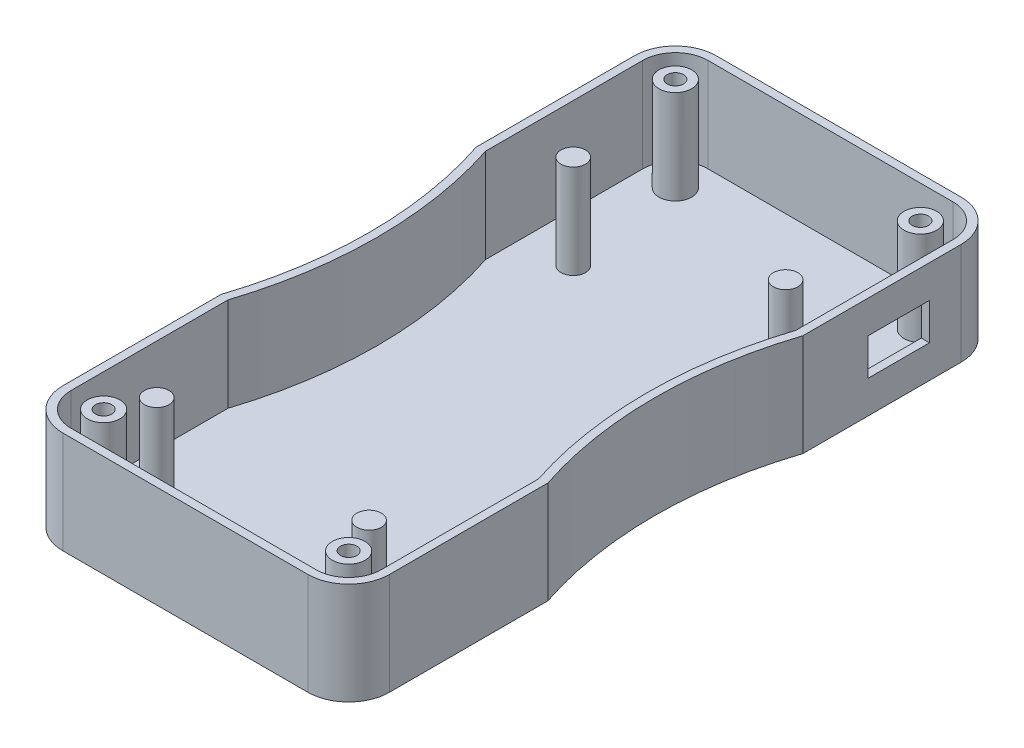
from build123d import *

# Parameters (mm, degrees)
SKETCH1_W           = 80
SKETCH1_H           = 160
BOSS_EXTRUDE1_DEPTH = 25
SKETCH2_R           = 100
CUT_EXTRUDE1_DEPTH  = 181.623918682
FILLET1_R           = 10
SHELL1_T            = -2
SKETCH3_R           = 4
BOSS_EXTRUDE2_DEPTH = 23
SKETCH6_R           = 2
CUT_EXTRUDE2_DEPTH  = 10
SKETCH7_R           = 3
BOSS_EXTRUDE3_DEPTH = 23
SKETCH8_W           = 15
SKETCH8_H           = 9
CUT_EXTRUDE3_DEPTH  = 10


with BuildPart() as part:
    # Sketch1 → Boss-Extrude1 (new body)
    with BuildSketch(Plane(origin=(0, 0, 0), x_dir=(1, 0, 0), z_dir=(0, 1, 0))):
        with Locations((40, 80)):
            Rectangle(SKETCH1_W, SKETCH1_H)
    extrude(amount=-BOSS_EXTRUDE1_DEPTH)

    # Sketch2 → Cut-Extrude1 (cut, through all)
    with BuildSketch(Plane(origin=(0, 0, 0), x_dir=(1, 0, 0), z_dir=(0, 1, 0))):
        with Locations((-95, 80)):
            Circle(SKETCH2_R)
        with Locations((175, 80)):
            Circle(SKETCH2_R)
    extrude(amount=-CUT_EXTRUDE1_DEPTH, mode=Mode.SUBTRACT)

    # Fillet1
    fillet1_edges = [part.edges().sort_by_distance(p)[0] for p in [
        (0, -12.5, -160),
        (80, -12.5, -160),
        (80, -12.5, 0),
        (0, -12.5, 0),
    ]]
    fillet(fillet1_edges, radius=FILLET1_R)

    # Shell1
    shell1_openings = [part.faces().sort_by_distance(p)[0] for p in [
        (40, 0, -80),
    ]]
    offset(amount=SHELL1_T, openings=shell1_openings, kind=Kind.INTERSECTION)

    # Sketch3 → Boss-Extrude2 (add, through all)
    with BuildSketch(Plane(origin=(0, -23, 0), x_dir=(1, 0, 0), z_dir=(0, 1, 0))):
        with Locations(Location((10, 150, 0), (0, 0, 90))):
            Circle(SKETCH3_R)
        with Locations(Location((70, 150, 0), (0, 0, 90))):
            Circle(SKETCH3_R)
        with Locations(Location((70, 10, 0), (0, 0, 90))):
            Circle(SKETCH3_R)
        with Locations(Location((10, 10, 0), (0, 0, 90))):
            Circle(SKETCH3_R)
    extrude(amount=BOSS_EXTRUDE2_DEPTH)

    # Sketch6 → Cut-Extrude2 (cut)
    with BuildSketch(Plane(origin=(0, 0, 0), x_dir=(1, 0, 0), z_dir=(0, 1, 0))):
        with Locations(Location((10, 150, 0), (0, 0, 270))):
            Circle(SKETCH6_R)
        with Locations(Location((70, 150, 0), (0, 0, 90))):
            Circle(SKETCH6_R)
        with Locations(Location((70, 10, 0), (0, 0, 270))):
            Circle(SKETCH6_R)
        with Locations(Location((10, 10, 0), (0, 0, 90))):
            Circle(SKETCH6_R)
    extrude(amount=-CUT_EXTRUDE2_DEPTH, mode=Mode.SUBTRACT)

    # Sketch7 → Boss-Extrude3 (add, through all)
    with BuildSketch(Plane(origin=(0, -23, 0), x_dir=(1, 0, 0), z_dir=(0, 1, 0))):
        with Locations(Location((14, 121, 0), (0, 0, 90))):
            Circle(SKETCH7_R)
        with Locations(Location((66, 121, 0), (0, 0, 90))):
            Circle(SKETCH7_R)
        with Locations(Location((14, 19, 0), (0, 0, 90))):
            Circle(SKETCH7_R)
        with Locations(Location((66, 19, 0), (0, 0, 90))):
            Circle(SKETCH7_R)
    extrude(amount=BOSS_EXTRUDE3_DEPTH)

    # Sketch8 → Cut-Extrude3 (cut)
    with BuildSketch(Plane(origin=(80, 0, 0), x_dir=(0, 0, -1), z_dir=(1, 0, 0))):
        with Locations((134.724989992, -12.5)):
            Rectangle(SKETCH8_W, SKETCH8_H)
    extrude(amount=-CUT_EXTRUDE3_DEPTH, mode=Mode.SUBTRACT)


solid = part.part
